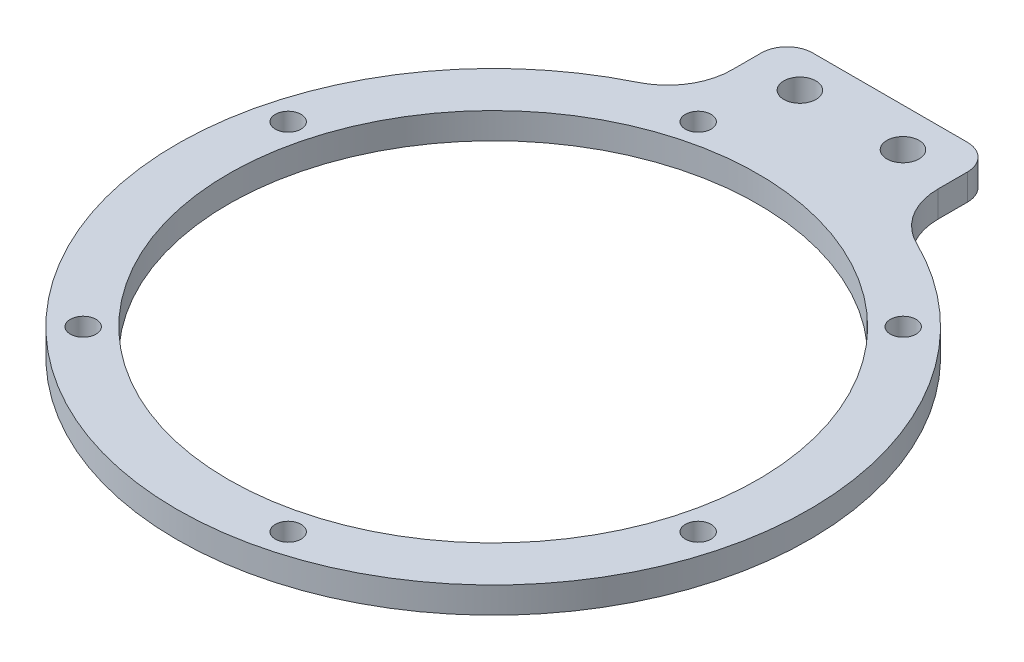
from build123d import *

# Parameters (mm, degrees)
SKETCH1_R           = 41.1
SKETCH1_R_2         = 2
SKETCH1_R_3         = 2.5
BOSS_EXTRUDE2_DEPTH = 4.064
FILLET1_R           = 4
FILLET2_R           = 10


with BuildPart() as part:
    # Sketch1 → Boss-Extrude2 (new body)
    with BuildSketch(Plane(origin=(0, 0, 0), x_dir=(1, 0, 0), z_dir=(0, 1, 0))):
        with BuildLine():
            Line((-16, 46.419931064), (-16, 61.6))
            Line((-16, 61.6), (16, 61.6))
            Line((16, 61.6), (16, 46.419931064))
            ThreePointArc((16, 46.419931064), (0, -49.1), (-16, 46.419931064))
        make_face()
        with Locations(Location((0, 0, 0), (0, 0, 270))):
            Circle(SKETCH1_R, mode=Mode.SUBTRACT)
        with Locations(Location((-11.64685703, 43.466662183, 0), (0, 0, 270))):
            Circle(SKETCH1_R_2, mode=Mode.SUBTRACT)
        with Locations(Location((31.819805153, 31.819805153, 0), (0, 0, 270))):
            Circle(SKETCH1_R_2, mode=Mode.SUBTRACT)
        with Locations(Location((43.466662183, -11.64685703, 0), (0, 0, 270))):
            Circle(SKETCH1_R_2, mode=Mode.SUBTRACT)
        with Locations(Location((11.64685703, -43.466662183, 0), (0, 0, 270))):
            Circle(SKETCH1_R_2, mode=Mode.SUBTRACT)
        with Locations(Location((-31.819805153, -31.819805153, 0), (0, 0, 270))):
            Circle(SKETCH1_R_2, mode=Mode.SUBTRACT)
        with Locations(Location((-43.466662183, 11.64685703, 0), (0, 0, 270))):
            Circle(SKETCH1_R_2, mode=Mode.SUBTRACT)
        with Locations(Location((-8, 55.6, 0), (0, 0, 270))):
            Circle(SKETCH1_R_3, mode=Mode.SUBTRACT)
        with Locations(Location((8, 55.6, 0), (0, 0, 270))):
            Circle(SKETCH1_R_3, mode=Mode.SUBTRACT)
    extrude(amount=BOSS_EXTRUDE2_DEPTH)

    # Fillet1
    fillet1_edges = [part.edges().sort_by_distance(p)[0] for p in [
        (-16, 2.032, -61.6),
        (16, 2.032, -61.6),
    ]]
    fillet(fillet1_edges, radius=FILLET1_R)

    # Fillet2
    fillet2_edges = [part.edges().sort_by_distance(p)[0] for p in [
        (16, 2.032, -46.419931064),
        (-16, 2.032, -46.419931064),
    ]]
    fillet(fillet2_edges, radius=FILLET2_R)


solid = part.part
